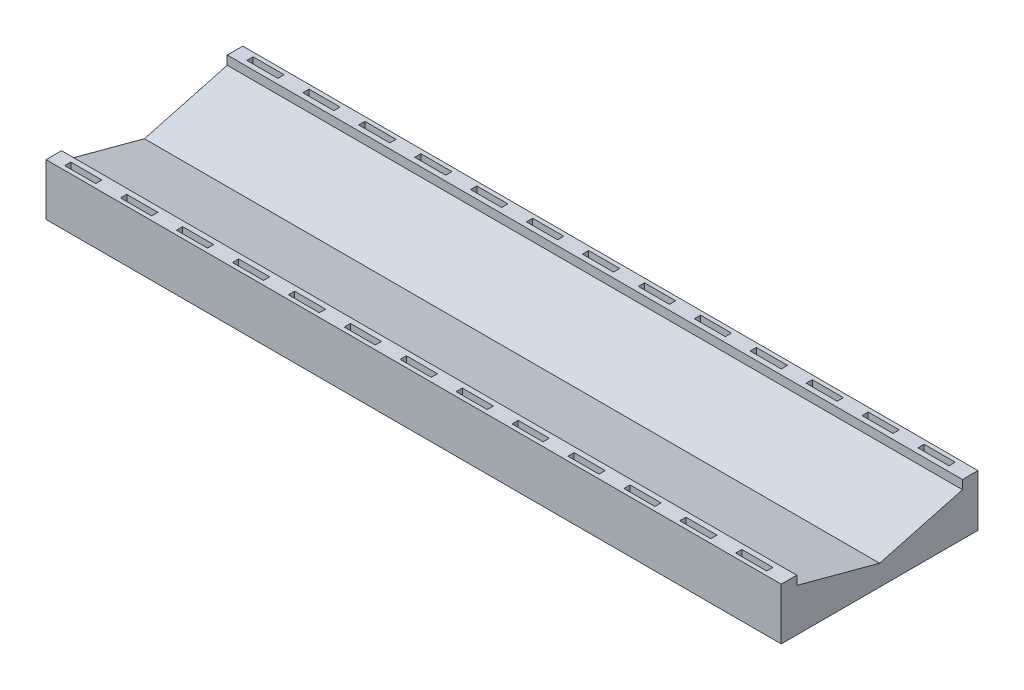
from build123d import *

# Parameters (mm, degrees)
SKETCH1_W               = 38
SKETCH1_H               = 9.5
BOSS_EXTRUDE1_DEPTH     = 2.5
SKETCH2_W               = 1.5
SKETCH2_H               = 0.3
CUT_EXTRUDE1_DEPTH      = 2
LPATTERN1_COUNT         = 14
LPATTERN1_PITCH         = 2.7
LPATTERN1_COUNT_DIR2    = 2
LPATTERN1_PITCH_DIR2    = 8.8
CUT_EXTRUDE2_DEPTH      = 40.249203814
CUT_EXTRUDE2_DEPTH_BACK = 40.249203814
CUT_EXTRUDE3_DEPTH      = 2.5


with BuildPart() as part:
    # Sketch1 → Boss-Extrude1 (new body)
    with BuildSketch(Plane(origin=(0, 0, 0), x_dir=(1, 0, 0), z_dir=(0, 1, 0))):
        with Locations((19, 4.75)):
            Rectangle(SKETCH1_W, SKETCH1_H)
    extrude(amount=BOSS_EXTRUDE1_DEPTH)

    # Sketch2 → Cut-Extrude1 (cut)
    with BuildSketch(Plane(origin=(0, 2.5, 0), x_dir=(1, 0, 0), z_dir=(0, 1, 0))):
        with Locations((1.25, 0.35)):
            Rectangle(SKETCH2_W, SKETCH2_H)
    cut_extrude1 = extrude(amount=-CUT_EXTRUDE1_DEPTH, mode=Mode.SUBTRACT)

    # LPattern1: Cut-Extrude1 14 × 2
    with Locations(*[(i * LPATTERN1_PITCH, 0, -j * LPATTERN1_PITCH_DIR2) for i in range(LPATTERN1_COUNT) for j in range(LPATTERN1_COUNT_DIR2) if (i, j) != (0, 0)]):
        add(cut_extrude1, mode=Mode.SUBTRACT)

    # Sketch4 → Cut-Extrude2 (cut, two sides: drawn at the far end of the back side and taken through both)
    with BuildSketch(Plane(origin=(38, 0, 0), x_dir=(0, 0, -1), z_dir=(1, 0, 0)).offset(-CUT_EXTRUDE2_DEPTH_BACK)):
        Polygon((0.75, 30.700274723), (0.75, 2.5), (0.75, 2.07179677), (4.75, 1), (8.75, 2.07179677), (8.75, 2.5), (8.75, 30.700274723), (8.75, 87.10082417), (0.75, 87.10082417), align=None)
    extrude(amount=CUT_EXTRUDE2_DEPTH + CUT_EXTRUDE2_DEPTH_BACK, mode=Mode.SUBTRACT)

    # Sketch5 → Cut-Extrude3 (cut)
    with BuildSketch(Plane.ZY):
        Polygon((-0.75, 2.5), (-0.75, 2.07179677), (-4.75, 1), (-8.75, 2.07179677), (-8.75, 2.5), (-9.5, 2.5), (-9.5, 0), (0, 0), (0, 2.5), align=None)
    extrude(amount=-CUT_EXTRUDE3_DEPTH, mode=Mode.SUBTRACT)


solid = part.part
